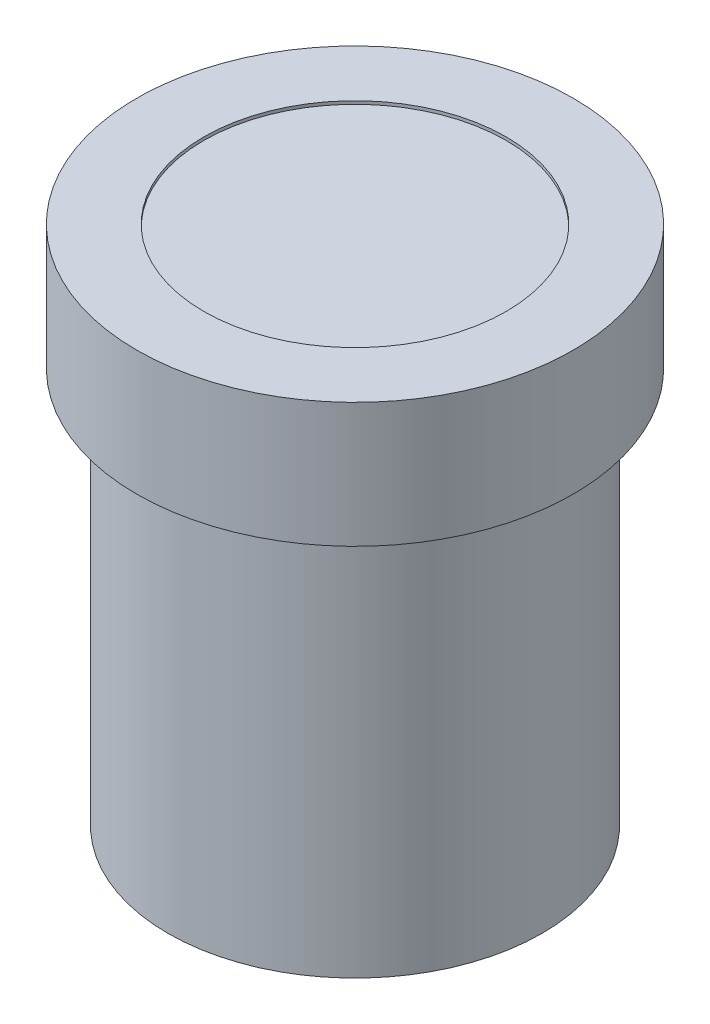
from build123d import *

# Parameters (mm, degrees)
SKETCH1_R           = 6
SKETCH1_R_2         = 2.25
BOSS_EXTRUDE1_DEPTH = 12.7
SKETCH2_R           = 7
SKETCH2_R_2         = 4.85
BOSS_EXTRUDE2_DEPTH = 4
BOSS_EXTRUDE3_START = 3.8
SKETCH2_2_R         = 4.85
BOSS_EXTRUDE3_DEPTH = 0.1


with BuildPart() as part:
    # Sketch1 → Boss-Extrude1 (new body)
    with BuildSketch(Plane(origin=(0, 0, 0), x_dir=(1, 0, 0), z_dir=(0, 1, 0))):
        Circle(SKETCH1_R)
        Circle(SKETCH1_R_2, mode=Mode.SUBTRACT)
    extrude(amount=BOSS_EXTRUDE1_DEPTH)

    # Sketch2 → Boss-Extrude2 (add)
    with BuildSketch(Plane(origin=(0, 12.7, 0), x_dir=(1, 0, 0), z_dir=(0, 1, 0))):
        Circle(SKETCH2_R)
        Circle(SKETCH2_R_2, mode=Mode.SUBTRACT)
    extrude(amount=BOSS_EXTRUDE2_DEPTH)

    # Sketch2<2> → Boss-Extrude3 (add)
    with BuildSketch(Plane(origin=(0, 12.7, 0), x_dir=(1, 0, 0), z_dir=(0, 1, 0)).offset(BOSS_EXTRUDE3_START)):
        Circle(SKETCH2_2_R)
    extrude(amount=BOSS_EXTRUDE3_DEPTH)


solid = part.part
